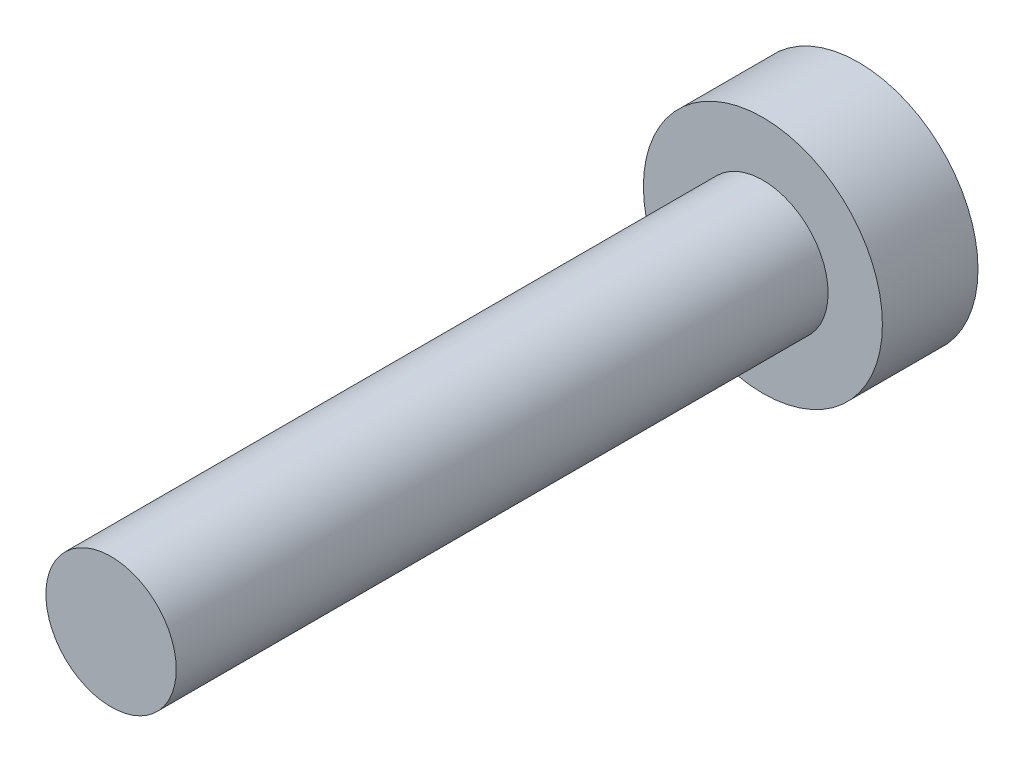
from build123d import *

# Parameters (mm, degrees)
SKETCH_1_R      = 2.75
EXTRUDE_1_DEPTH = 2.2
SKETCH_2_R      = 1.5
EXTRUDE_2_DEPTH = 15


with BuildPart() as part:
    # 草图1 → 凸台-拉伸1 (new body)
    with BuildSketch(Plane.XY):
        Circle(SKETCH_1_R)
    extrude(amount=EXTRUDE_1_DEPTH)

    # 草图2 → 凸台-拉伸2 (add)
    with BuildSketch(Plane.XY.offset(2.2)):
        Circle(SKETCH_2_R)
    extrude(amount=EXTRUDE_2_DEPTH)


solid = part.part
